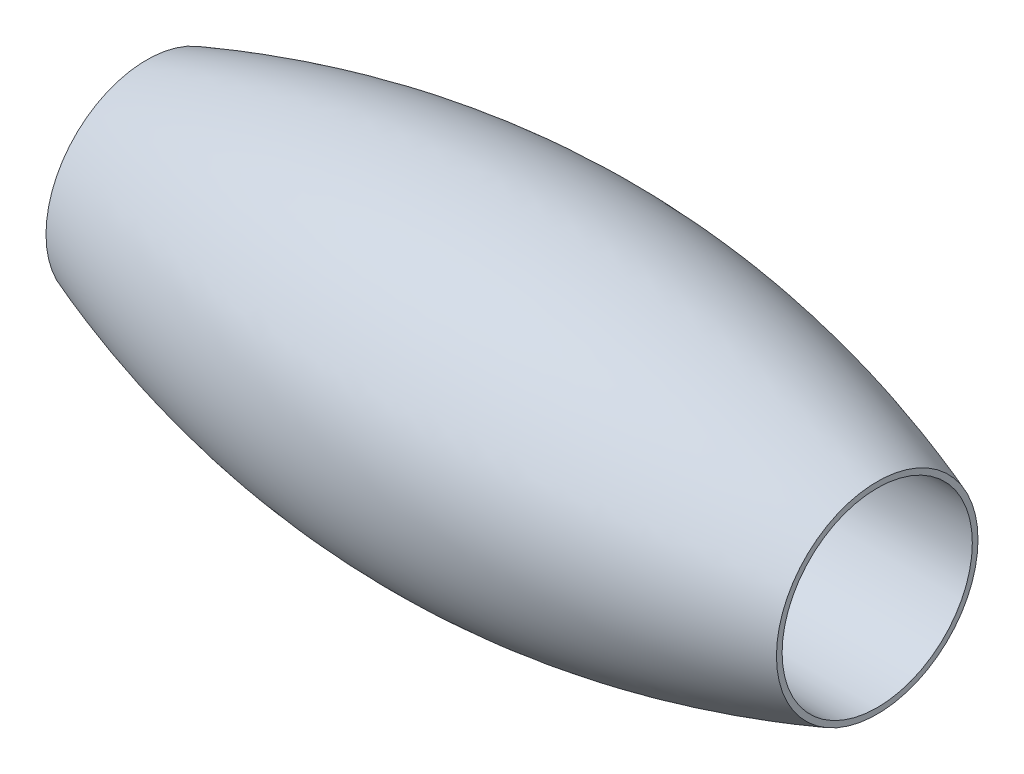
from build123d import *


with BuildPart() as part:
    # Sketch1 → Revolve1 (revolve)
    with BuildSketch(Plane.XY, mode=Mode.PRIVATE) as revolve1_sk:
        with BuildLine():
            Line((0.254, 1.6820896), (0.254, 1.5875))
            Line((0.254, 1.5875), (12.446, 1.5875))
            Line((12.446, 1.5875), (12.446, 1.6820896))
            add(Edge.make_bspline(
                [(12.446, 1.6820896), (6.35, 3.9059104), (0.254, 1.6820896)],
                knots=[0.5, 0.5, 0.5, 1.46, 1.46, 1.46], degree=2))
        make_face()
    revolve(revolve1_sk.sketch.rotate(Axis((0, 0, 0), (1, 0, 0)), 90), axis=Axis((0, 0, 0), (1, 0, 0)))


solid = part.part
